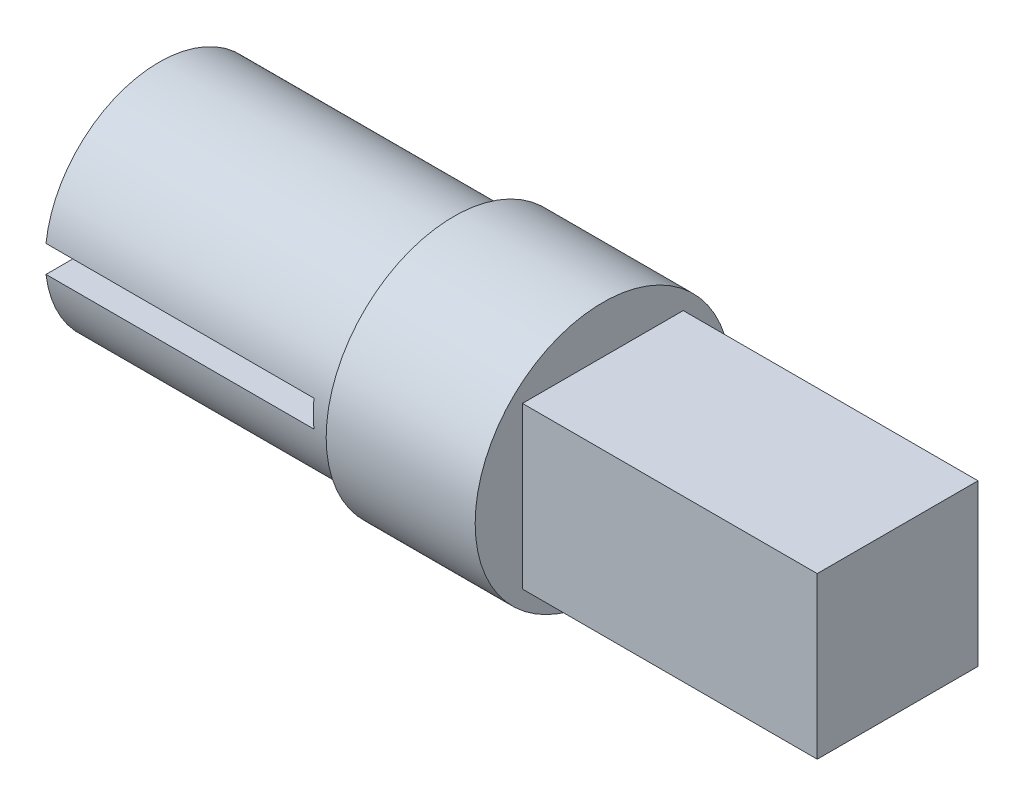
from build123d import *

# Parameters (mm, degrees)
SKETCH1_R           = 4.765
BOSS_EXTRUDE1_DEPTH = 2.78
SKETCH2_R           = 4.25
BOSS_EXTRUDE2_DEPTH = 11
SKETCH3_W           = 6
SKETCH3_H           = 6
BOSS_EXTRUDE3_DEPTH = 11
CUT_EXTRUDE1_START  = 11
SKETCH4_R           = 2.85
CUT_EXTRUDE1_DEPTH  = 11
CUT_EXTRUDE2_START  = -10
CUT_EXTRUDE2_DEPTH  = 10


with BuildPart() as part:
    # Sketch1 → Boss-Extrude1 (new, symmetric)
    with BuildSketch(Plane(origin=(0, 0, 0), x_dir=(0, 0, -1), z_dir=(1, 0, 0))):
        Circle(SKETCH1_R)
    extrude(amount=BOSS_EXTRUDE1_DEPTH, both=True)

    # Sketch2 → Boss-Extrude2 (add)
    with BuildSketch(Plane.ZY.offset(2.78)):
        Circle(SKETCH2_R)
    extrude(amount=BOSS_EXTRUDE2_DEPTH)

    # Sketch3 → Boss-Extrude3 (add)
    with BuildSketch(Plane(origin=(2.78, 0, 0), x_dir=(0, 0, -1), z_dir=(1, 0, 0))):
        Rectangle(SKETCH3_W, SKETCH3_H)
    extrude(amount=BOSS_EXTRUDE3_DEPTH)

    # Sketch4 → Cut-Extrude1 (cut)
    with BuildSketch(Plane.ZY.offset(2.78).offset(CUT_EXTRUDE1_START)):
        Circle(SKETCH4_R)
    extrude(amount=-CUT_EXTRUDE1_DEPTH, mode=Mode.SUBTRACT)

    # Sketch5 → Cut-Extrude2 (cut)
    with BuildSketch(Plane.ZY.offset(13.78).offset(CUT_EXTRUDE2_START)):
        with BuildLine():
            ThreePointArc((-4.220485754, 0.5), (-4.25, 0), (-4.220485754, -0.5))
            Line((-4.220485754, -0.5), (-2.805797569, -0.5))
            ThreePointArc((-2.805797569, -0.5), (-2.85, 0), (-2.805797569, 0.5))
            Line((-2.805797569, 0.5), (-4.220485754, 0.5))
        make_face()
        with BuildLine():
            Line((2.805797569, -0.5), (4.220485754, -0.5))
            ThreePointArc((4.220485754, -0.5), (4.242615022, -0.250435167), (4.25, 0))
            ThreePointArc((4.25, 0), (4.242615022, 0.250435167), (4.220485754, 0.5))
            Line((4.220485754, 0.5), (2.805797569, 0.5))
            ThreePointArc((2.805797569, 0.5), (2.838927885, 0.250975026), (2.85, 0))
            ThreePointArc((2.85, 0), (2.838927885, -0.250975026), (2.805797569, -0.5))
        make_face()
        with BuildLine():
            ThreePointArc((-4.73869444, 0.5), (-4.765, 0), (-4.73869444, -0.5))
            Line((-4.73869444, -0.5), (-4.220485754, -0.5))
            ThreePointArc((-4.220485754, -0.5), (-4.25, 0), (-4.220485754, 0.5))
            Line((-4.220485754, 0.5), (-4.73869444, 0.5))
        make_face()
        with BuildLine():
            ThreePointArc((-2.805797569, 0.5), (-2.85, 0), (-2.805797569, -0.5))
            Line((-2.805797569, -0.5), (2.805797569, -0.5))
            ThreePointArc((2.805797569, -0.5), (2.838927885, -0.250975026), (2.85, 0))
            ThreePointArc((2.85, 0), (2.838927885, 0.250975026), (2.805797569, 0.5))
            Line((2.805797569, 0.5), (-2.805797569, 0.5))
        make_face()
        with BuildLine():
            ThreePointArc((4.25, 0), (4.242615022, -0.250435167), (4.220485754, -0.5))
            Line((4.220485754, -0.5), (4.73869444, -0.5))
            ThreePointArc((4.73869444, -0.5), (4.765, 0), (4.73869444, 0.5))
            Line((4.73869444, 0.5), (4.220485754, 0.5))
            ThreePointArc((4.220485754, 0.5), (4.242615022, 0.250435167), (4.25, 0))
        make_face()
    extrude(amount=CUT_EXTRUDE2_DEPTH, mode=Mode.SUBTRACT)


solid = part.part
